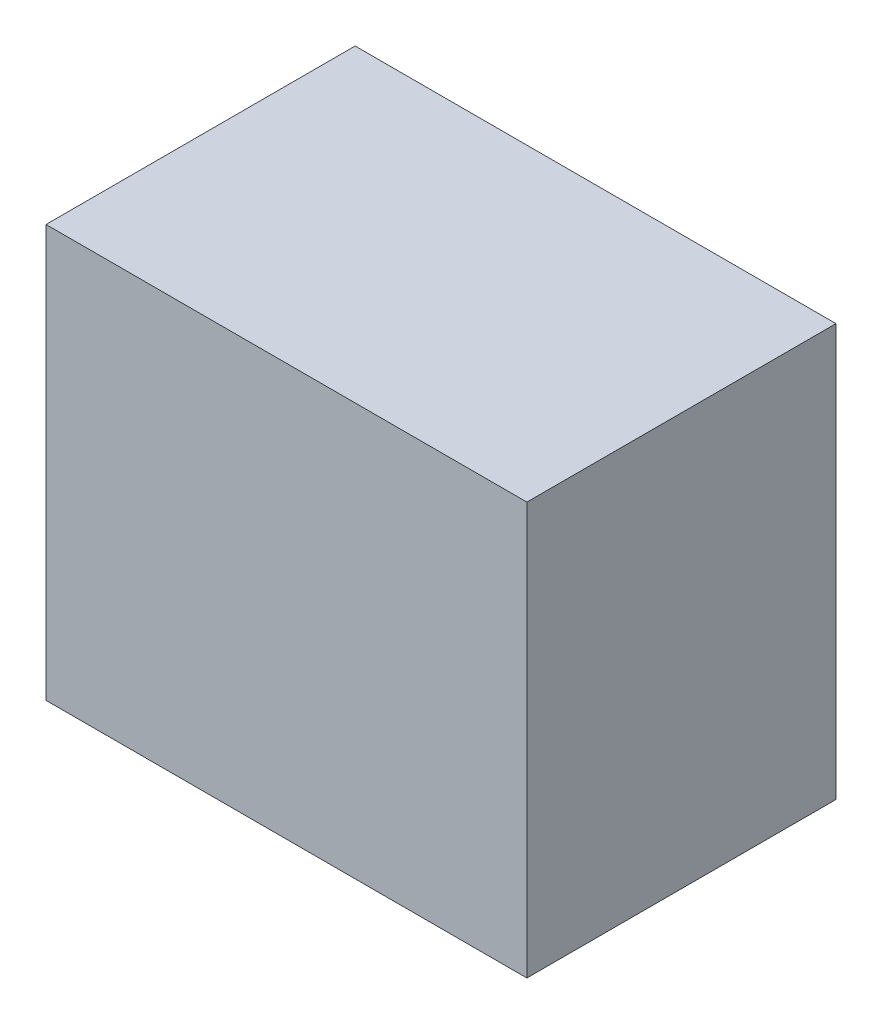
from build123d import *

# Parameters (mm, degrees)
SKETCH_1_W             = 700
SKETCH_1_H             = 450
EXTRUDE_1_DEPTH        = 600
SKETCH_2_W             = 126.57796077
SKETCH_2_H             = 94.230259684
EXTRUDE_2_DEPTH        = 80
SKETCH_3_R             = 100
CUT_EXTRUDE_1_DEPTH    = 2
SKETCH_4_W             = 200
SKETCH_4_H             = 85
EXTRUDE_3_DEPTH        = 2
SKETCH_5_R             = 15
EXTRUDE_4_DEPTH        = 30
SKETCH_6_W             = 60
SKETCH_6_H             = 120
EXTRUDE_5_DEPTH        = 5
SKETCH_7_W             = 85
SKETCH_7_H             = 70
EXTRUDE_6_DEPTH        = 1
SKETCH_8_W             = 3
SKETCH_8_H             = 85
CUT_EXTRUDE_2_DEPTH    = 2
PATTERN_LINEAR_1_COUNT = 38
PATTERN_LINEAR_1_PITCH = 8


with BuildPart() as part:
    # 草图1 → 凸台-拉伸1 (new body)
    with BuildSketch(Plane(origin=(0, 0, 0), x_dir=(1, 0, 0), z_dir=(0, 1, 0))):
        Rectangle(SKETCH_1_W, SKETCH_1_H)
    extrude(amount=EXTRUDE_1_DEPTH)

    # 草图2 → 凸台-拉伸2 (add)
    with BuildSketch(Plane.ZY.offset(350)):
        with Locations((76.649987355, 101.694528127)):
            Rectangle(SKETCH_2_W, SKETCH_2_H)
    extrude(amount=EXTRUDE_2_DEPTH)

    # 草图3 → 切除-拉伸1 (cut)
    with BuildSketch(Plane(origin=(0, 0, -225), x_dir=(-1, 0, 0), z_dir=(0, 0, -1))):
        with Locations((160, 190)):
            Circle(SKETCH_3_R)
    extrude(amount=-CUT_EXTRUDE_1_DEPTH, mode=Mode.SUBTRACT)

    # 草图4 → 凸台-拉伸3 (add)
    with BuildSketch(Plane(origin=(0, 0, -225), x_dir=(-1, 0, 0), z_dir=(0, 0, -1))):
        with Locations((-190, 517.5)):
            Rectangle(SKETCH_4_W, SKETCH_4_H)
    extrude(amount=EXTRUDE_3_DEPTH)

    # 草图5 → 凸台-拉伸4 (add)
    with BuildSketch(Plane(origin=(0, 0, -227), x_dir=(-1, 0, 0), z_dir=(0, 0, -1))):
        with Locations((-130, 517.5)):
            Circle(SKETCH_5_R)
    extrude(amount=EXTRUDE_4_DEPTH)

    # 草图6 → 凸台-拉伸5 (add)
    with BuildSketch(Plane(origin=(0, 0, -225), x_dir=(-1, 0, 0), z_dir=(0, 0, -1))):
        with Locations((-260, 295)):
            Rectangle(SKETCH_6_W, SKETCH_6_H)
    extrude(amount=EXTRUDE_5_DEPTH)

    # 草图7 → 凸台-拉伸6 (add)
    with BuildSketch(Plane(origin=(0, 0, -225), x_dir=(-1, 0, 0), z_dir=(0, 0, -1))):
        Polygon((-135, 129.282032303), (-175, 60), (-95, 60), align=None)
        with Locations((-262.5, 95)):
            Rectangle(SKETCH_7_W, SKETCH_7_H)
    extrude(amount=EXTRUDE_6_DEPTH)

    # 草图8 → 切除-拉伸2 (cut)
    with BuildSketch(Plane(origin=(0, 0, -225), x_dir=(-1, 0, 0), z_dir=(0, 0, -1))):
        with Locations((11.5, 517.5)):
            Rectangle(SKETCH_8_W, SKETCH_8_H)
    cut_extrude_2 = extrude(amount=-CUT_EXTRUDE_2_DEPTH, mode=Mode.SUBTRACT)

    # 阵列(线性)1: 切除-拉伸2 ×38
    with Locations(*[(-i * PATTERN_LINEAR_1_PITCH, 0, 0) for i in range(1, PATTERN_LINEAR_1_COUNT)]):
        add(cut_extrude_2, mode=Mode.SUBTRACT)


solid = part.part
